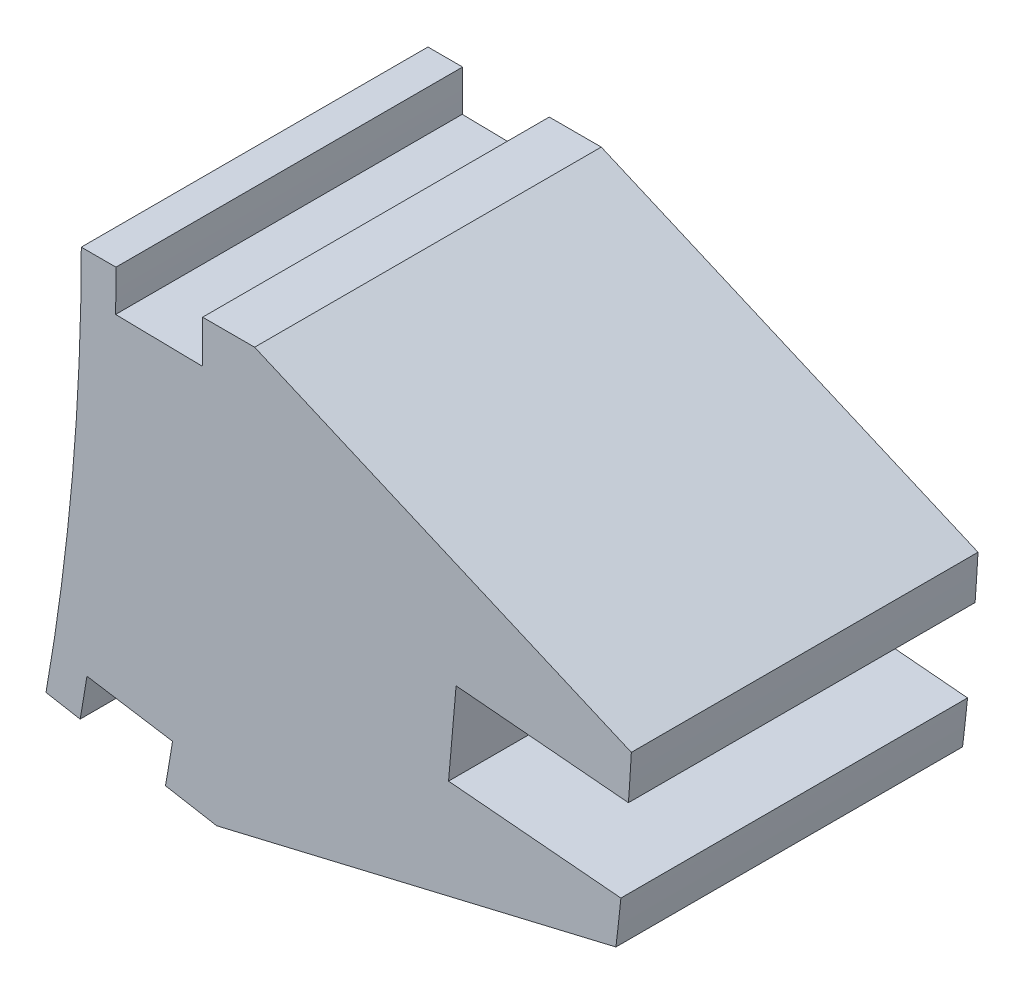
from build123d import *

# Parameters (mm, degrees)
EXTRUDE_1_DEPTH     = 100
CUT_EXTRUDE_1_DEPTH = 849.335356313
CUT_EXTRUDE_2_DEPTH = 849.335356313
CUT_EXTRUDE_3_REACH = 850.335


with BuildPart() as part:
    # 草图1 → 凸台-拉伸1 (new body)
    with BuildSketch(Plane.XY):
        with BuildLine():
            Line((670, 0), (830, 0))
            ThreePointArc((830, 0), (826.841599416, -72.339266481), (817.390435, -144.127987464))
            Line((817.390435, -144.127987464), (659.821194518, -116.344279037))
            ThreePointArc((659.821194518, -116.344279037), (667.450447721, -58.394347641), (670, 0))
        make_face()
    extrude(amount=EXTRUDE_1_DEPTH)

    # 草图3 → 切除-拉伸1 (cut, through all)
    with BuildSketch(Plane.XY.offset(100)):
        with BuildLine():
            Line((778.121311296, -55.529045617), (777.031864512, -67.981479343))
            Line((777.031864512, -67.981479343), (775.942417727, -80.433913069))
            Line((775.942417727, -80.433913069), (825.658378988, -84.783496076))
            ThreePointArc((825.658378988, -84.783496076), (826.841599416, -72.339266481), (827.837272557, -59.878628624))
            Line((827.837272557, -59.878628624), (778.121311296, -55.529045617))
        make_face()
    extrude(amount=-CUT_EXTRUDE_1_DEPTH, mode=Mode.SUBTRACT)

    # 草图6 → 切除-拉伸2 (cut, through all)
    with BuildSketch(Plane(origin=(0, 0, 0), x_dir=(-1, 0, 0), z_dir=(0, 0, -1))):
        with BuildLine():
            Line((-669.669272048, -118.080760814), (-694.289465874, -122.421965255))
            ThreePointArc((-694.289465874, -122.421965255), (-695.331349084, -116.358562132), (-696.32028012, -110.286297853))
            Line((-696.32028012, -110.286297853), (-671.628071605, -106.375436227))
            ThreePointArc((-671.628071605, -106.375436227), (-670.674209045, -112.232371985), (-669.669272048, -118.080760814))
        make_face()
        with BuildLine():
            Line((-679.896432706, -11.867636377), (-704.892625085, -12.303946538))
            ThreePointArc((-704.892625085, -12.303946538), (-704.97315576, -6.152207526), (-705, 0))
            Line((-705, 0), (-680, 0))
            ThreePointArc((-680, 0), (-679.974107684, -5.934044139), (-679.896432706, -11.867636377))
        make_face()
    extrude(amount=-CUT_EXTRUDE_2_DEPTH, mode=Mode.SUBTRACT)

    # 草图7 → 切除-拉伸3 (cut, up to next)
    with BuildSketch(Plane.XY.offset(100), mode=Mode.PRIVATE) as cut_extrude_3_sk1:
        with BuildLine():
            Line((720, 0), (828.675083599, -46.878628624))
            ThreePointArc((828.675083599, -46.878628624), (829.668704781, -23.44867387), (830, 0))
            Line((830, 0), (720, 0))
        make_face()
    cut_extrude_3_tool1 = extrude(cut_extrude_3_sk1.sketch, amount=-CUT_EXTRUDE_3_REACH, mode=Mode.PRIVATE) & part.part
    # 草图7 → 切除-拉伸3 (cut, up to next)
    with BuildSketch(Plane.XY.offset(100), mode=Mode.PRIVATE) as cut_extrude_3_sk2:
        with BuildLine():
            Line((824.226035489, -97.731481226), (709.061582169, -125.02668792))
            Line((709.061582169, -125.02668792), (817.390435, -144.127987464))
            ThreePointArc((817.390435, -144.127987464), (821.135992387, -120.978022827), (824.226035489, -97.731481226))
        make_face()
    cut_extrude_3_tool2 = extrude(cut_extrude_3_sk2.sketch, amount=-CUT_EXTRUDE_3_REACH, mode=Mode.PRIVATE) & part.part
    add(cut_extrude_3_tool1.solids().sort_by_distance((793.038059, -15.657488, 100))[0], mode=Mode.SUBTRACT)
    add(cut_extrude_3_tool2.solids().sort_by_distance((783.708923, -122.289998, 100))[0], mode=Mode.SUBTRACT)


solid = part.part
